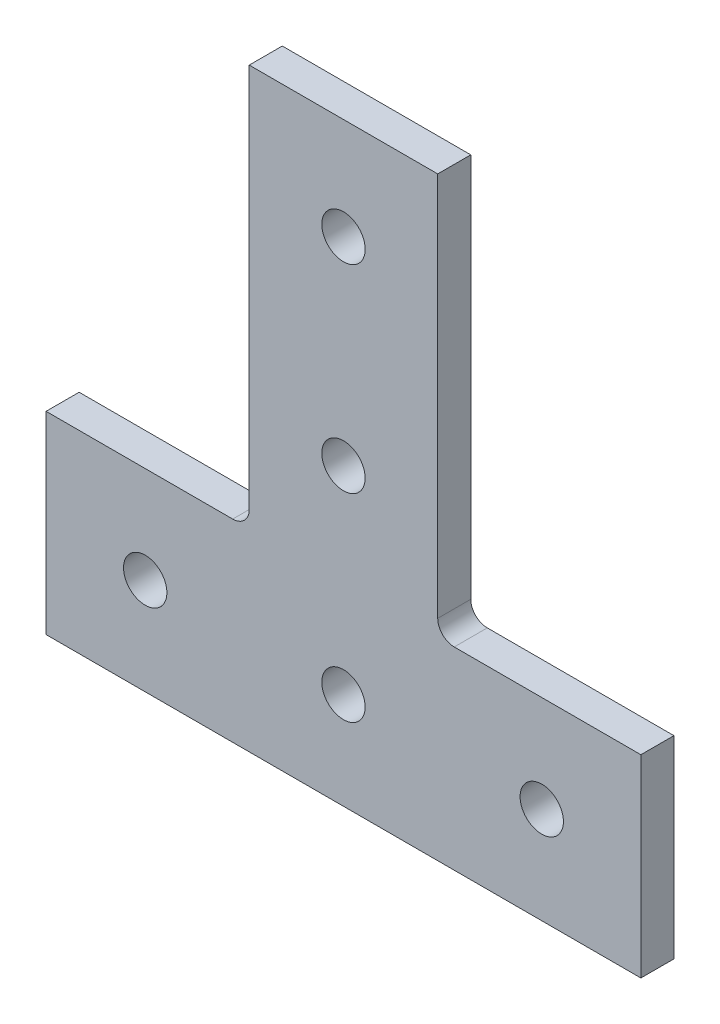
from build123d import *

# Parameters (mm, degrees)
BOSS_EXTRUDE1_DEPTH      = 3.175
BOSS_EXTRUDE1_DEPTH_BACK = 3.175
SKETCH4_R                = 4.1656
CUT_EXTRUDE1_DEPTH       = 82.071372876


with BuildPart() as part:
    # Sketch3 → Boss-Extrude1 (new, two sides: drawn at the far end of the back side and taken through both)
    with BuildSketch(Plane.XY.offset(-BOSS_EXTRUDE1_DEPTH_BACK)):
        with BuildLine():
            Line((57.15, -57.15), (-57.15, -57.15))
            Line((-57.15, -57.15), (-57.15, -19.9898))
            Line((-57.15, -19.9898), (-21.2852, -19.9898))
            ThreePointArc((-21.2852, -19.9898), (-19.04013597, -19.05986403), (-18.1102, -16.8148))
            Line((-18.1102, -16.8148), (-18.1102, 57.15))
            Line((-18.1102, 57.15), (18.1102, 57.15))
            Line((18.1102, 57.15), (18.1102, -16.8148))
            ThreePointArc((18.1102, -16.8148), (19.04013597, -19.05986403), (21.2852, -19.9898))
            Line((21.2852, -19.9898), (57.15, -19.9898))
            Line((57.15, -19.9898), (57.15, -57.15))
        make_face()
    extrude(amount=BOSS_EXTRUDE1_DEPTH + BOSS_EXTRUDE1_DEPTH_BACK)

    # Sketch4 → Cut-Extrude1 (cut, through all)
    with BuildSketch(Plane.XY.offset(3.175)):
        with Locations((38.1, -38.5699)):
            Circle(SKETCH4_R)
        with Locations((0, -38.5699)):
            Circle(SKETCH4_R)
        with Locations((-38.1, -38.5699)):
            Circle(SKETCH4_R)
        with Locations((0, -0.4699)):
            Circle(SKETCH4_R)
        with Locations(Location((0, 37.6301, 0), (0, 0, 180))):
            Circle(SKETCH4_R)
    extrude(amount=-CUT_EXTRUDE1_DEPTH, mode=Mode.SUBTRACT)


solid = part.part
